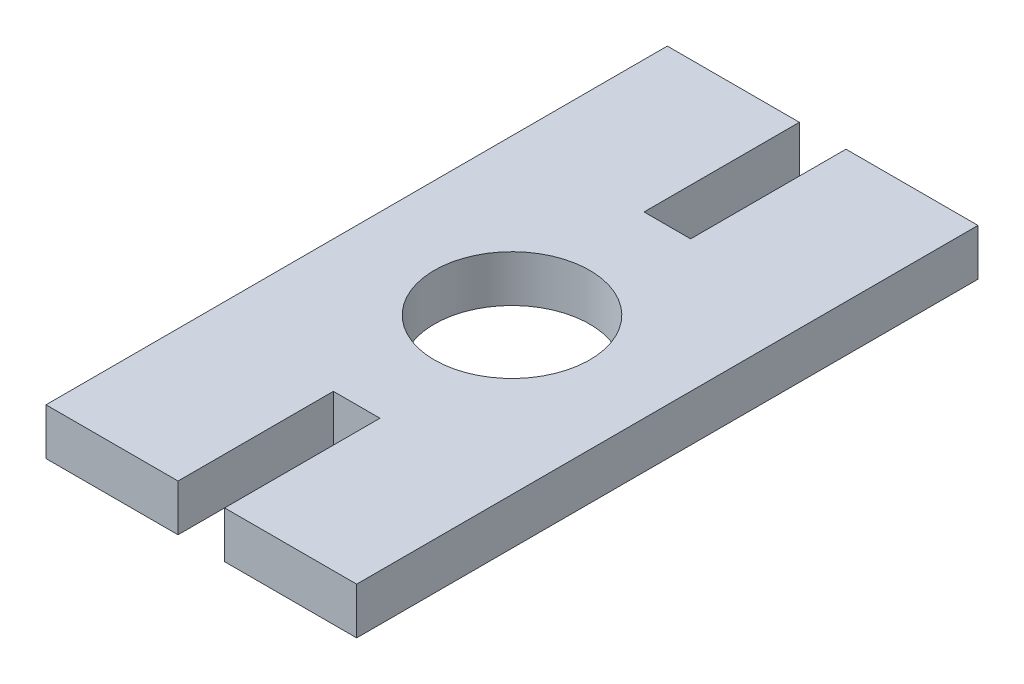
from build123d import *

# Parameters (mm, degrees)
SKETCH_2_R      = 5
EXTRUDE_1_DEPTH = 3


with BuildPart() as part:
    # 草图2 → 凸台-拉伸1 (new body)
    with BuildSketch(Plane(origin=(0, 0, 0), x_dir=(1, 0, 0), z_dir=(0, 1, 0))):
        Polygon((1.5, 10), (1.5, 20), (10, 20), (10, -20), (1.5, -20), (1.5, -10), (-1.5, -10), (-1.5, -20), (-10, -20), (-10, 20), (-1.5, 20), (-1.5, 10), align=None)
        with Locations(Location((0, 0, 0), (0, 0, 270))):
            Circle(SKETCH_2_R, mode=Mode.SUBTRACT)
    extrude(amount=EXTRUDE_1_DEPTH)


solid = part.part
